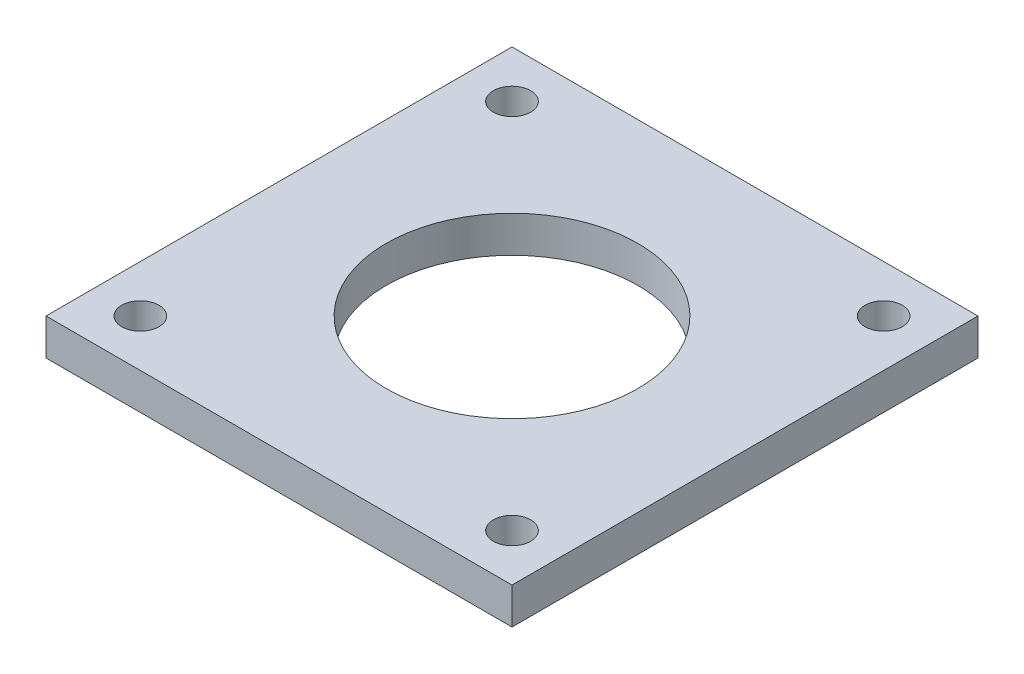
from build123d import *

# Parameters (mm, degrees)
SKETCH1_W           = 101.6
SKETCH1_H           = 101.6
SKETCH1_R           = 27.432
SKETCH1_R_2         = 4.064
BOSS_EXTRUDE1_DEPTH = 7.9375


with BuildPart() as part:
    # Sketch1 → Boss-Extrude1 (new body)
    with BuildSketch(Plane(origin=(0, 0, 0), x_dir=(1, 0, 0), z_dir=(0, 1, 0))):
        Rectangle(SKETCH1_W, SKETCH1_H)
        with Locations(Location((0, 0, 0), (0, 0, 270))):
            Circle(SKETCH1_R, mode=Mode.SUBTRACT)
        with Locations(Location((-40.513, 40.513, 0), (0, 0, 270))):
            Circle(SKETCH1_R_2, mode=Mode.SUBTRACT)
        with Locations(Location((40.513, 40.513, 0), (0, 0, 270))):
            Circle(SKETCH1_R_2, mode=Mode.SUBTRACT)
        with Locations(Location((-40.513, -40.513, 0), (0, 0, 270))):
            Circle(SKETCH1_R_2, mode=Mode.SUBTRACT)
        with Locations(Location((40.513, -40.513, 0), (0, 0, 270))):
            Circle(SKETCH1_R_2, mode=Mode.SUBTRACT)
    extrude(amount=BOSS_EXTRUDE1_DEPTH)


solid = part.part
